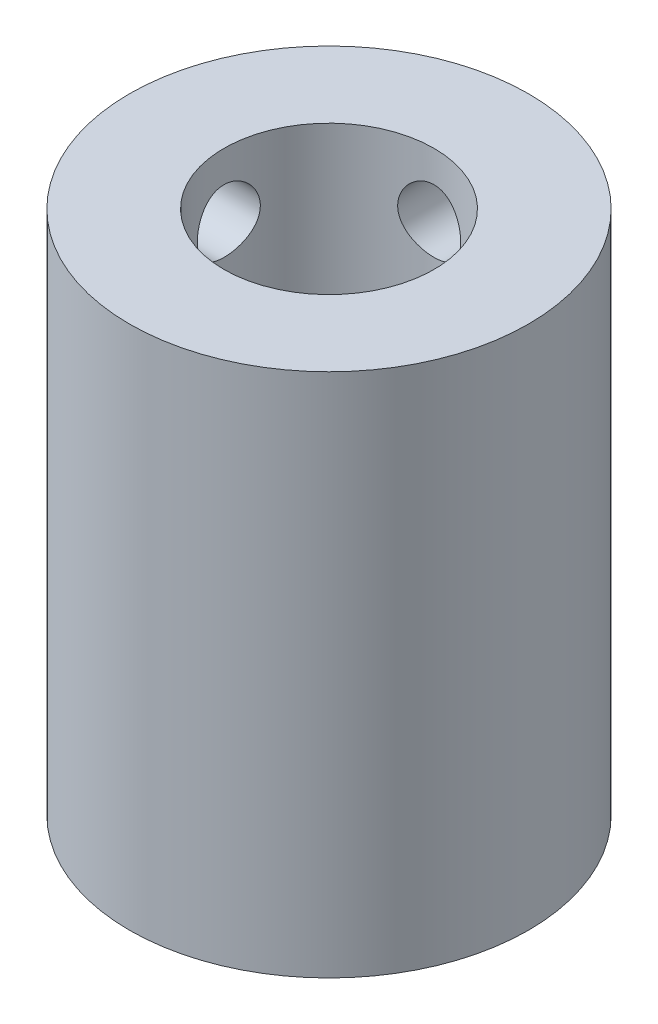
from build123d import *

# Parameters (mm, degrees)
SKETCH_1_R          = 9.5
SKETCH_1_R_2        = 3
EXTRUDE_1_DEPTH     = 25
SKETCH_2_R          = 5
CUT_EXTRUDE_1_DEPTH = 10
SKETCH_3_R          = 1.5
CUT_EXTRUDE_2_DEPTH = 10
SKETCH_4_R          = 1.5
CUT_EXTRUDE_3_DEPTH = 10


with BuildPart() as part:
    # 草图1 → 凸台-拉伸1 (new body)
    with BuildSketch(Plane(origin=(0, 0, 0), x_dir=(1, 0, 0), z_dir=(0, 1, 0))):
        with Locations(Location((0, 0, 0), (0, 0, 270))):
            Circle(SKETCH_1_R)
        with Locations(Location((0, 0, 0), (0, 0, 270))):
            Circle(SKETCH_1_R_2, mode=Mode.SUBTRACT)
    extrude(amount=EXTRUDE_1_DEPTH)

    # 草图2 → 切除-拉伸1 (cut)
    with BuildSketch(Plane(origin=(0, 25, 0), x_dir=(1, 0, 0), z_dir=(0, 1, 0))):
        with Locations(Location((0, 0, 0), (0, 0, 270))):
            Circle(SKETCH_2_R)
    extrude(amount=-CUT_EXTRUDE_1_DEPTH, mode=Mode.SUBTRACT)

    # 草图3 → 切除-拉伸2 (cut)
    with BuildSketch(Plane(origin=(0, 0, 0), x_dir=(0, 0, -1), z_dir=(1, 0, 0))):
        with Locations((0, 3)):
            Circle(SKETCH_3_R)
        with Locations((0, 22)):
            Circle(SKETCH_3_R)
    extrude(amount=-CUT_EXTRUDE_2_DEPTH, mode=Mode.SUBTRACT)

    # 草图4 → 切除-拉伸3 (cut)
    with BuildSketch(Plane.XY):
        with Locations(Location((0, 3, 0), (0, 0, 90))):
            Circle(SKETCH_4_R)
        with Locations((0, 22)):
            Circle(SKETCH_4_R)
    extrude(amount=-CUT_EXTRUDE_3_DEPTH, mode=Mode.SUBTRACT)


solid = part.part
